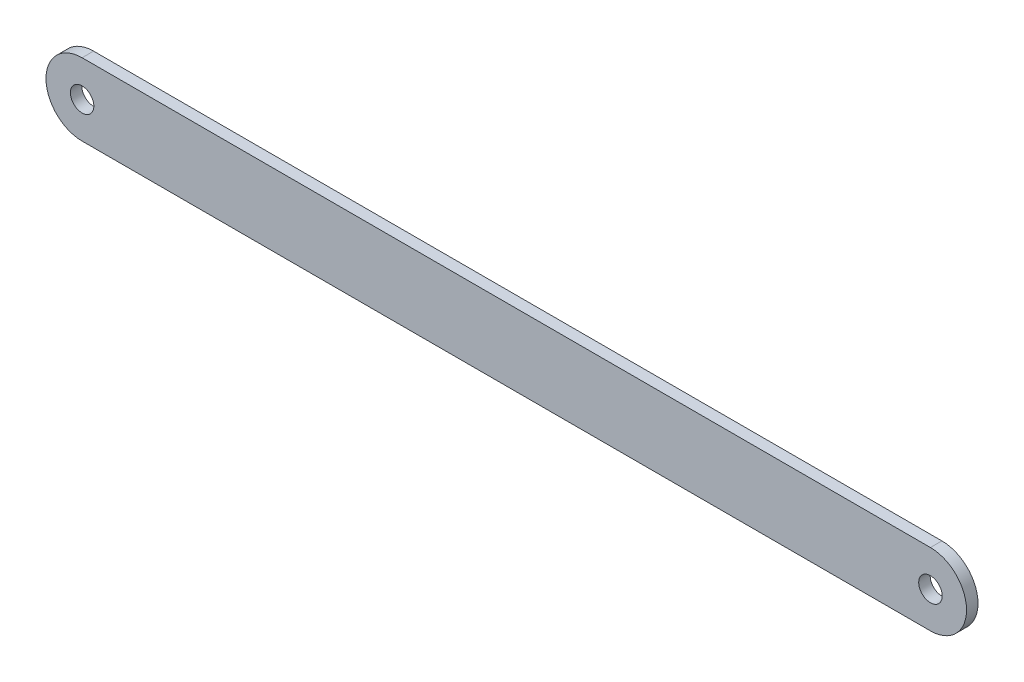
from build123d import *

# Parameters (mm, degrees)
SKETCH1_R           = 3.25
BOSS_EXTRUDE1_DEPTH = 3.175


with BuildPart() as part:
    # Sketch1 → Boss-Extrude1 (new body)
    with BuildSketch(Plane.XY):
        with BuildLine():
            Line((0, 10), (235, 10))
            ThreePointArc((235, 10), (245, 0), (235, -10))
            Line((235, -10), (0, -10))
            ThreePointArc((0, -10), (-10, 0), (0, 10))
        make_face()
        Circle(SKETCH1_R, mode=Mode.SUBTRACT)
        with Locations((235, 0)):
            Circle(SKETCH1_R, mode=Mode.SUBTRACT)
    extrude(amount=BOSS_EXTRUDE1_DEPTH)


solid = part.part
